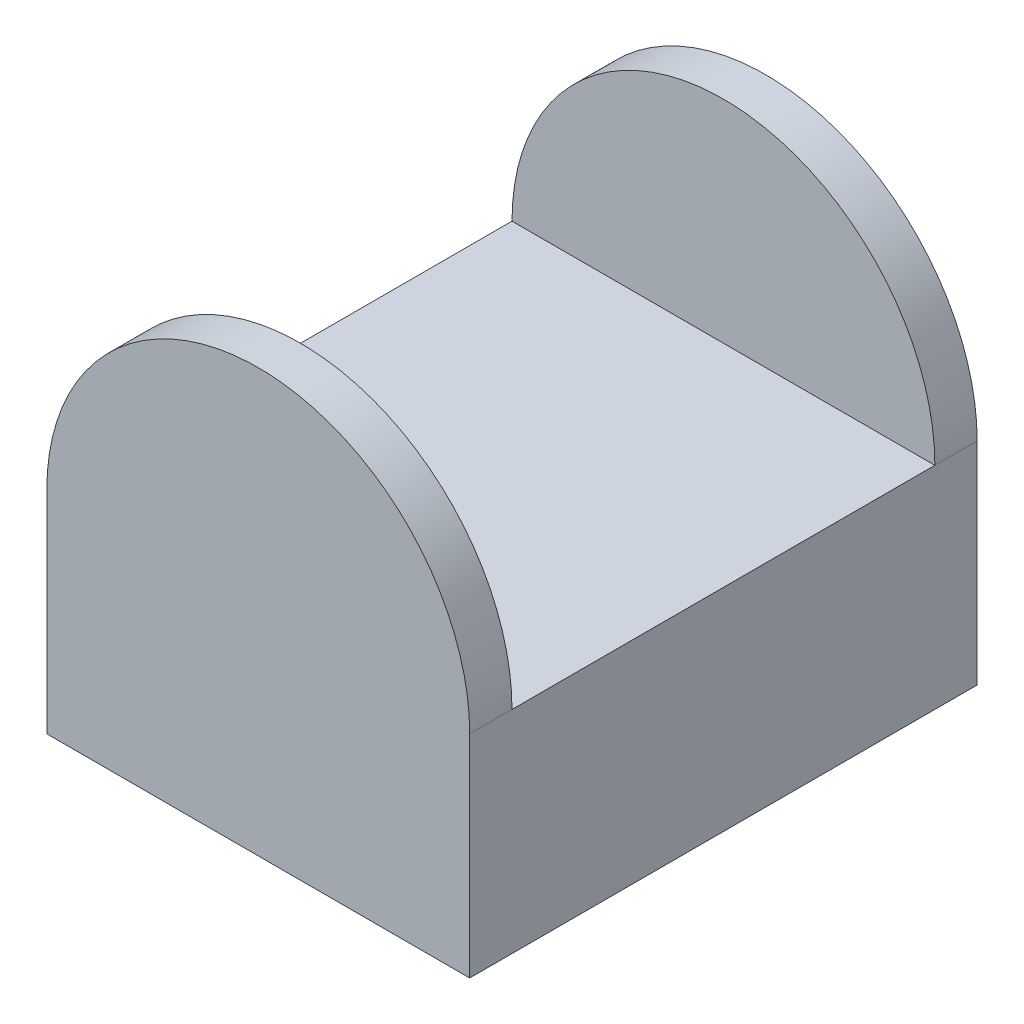
from build123d import *

# Parameters (mm, degrees)
BOSS_EXTRUDE1_DEPTH     = 30.48
CUT_EXTRUDE1_DEPTH      = 42.659097446
CUT_EXTRUDE1_DEPTH_BACK = 42.659097446
SKETCH3_W               = 25.4
SKETCH3_H               = 12.7


with BuildPart() as part:
    # Sketch2 → Boss-Extrude1 (new body)
    with BuildSketch(Plane.XY):
        with BuildLine():
            Line((-12.7, 0), (-12.7, -12.7))
            Line((-12.7, -12.7), (12.7, -12.7))
            Line((12.7, -12.7), (12.7, 0))
            ThreePointArc((12.7, 0), (0, 12.7), (-12.7, 0))
        make_face()
    extrude(amount=BOSS_EXTRUDE1_DEPTH)

    # Sketch3 → Cut-Extrude1 (cut, two sides: drawn at the far end of the back side and taken through both)
    with BuildSketch(Plane(origin=(12.7, 0, 0), x_dir=(0, 0, -1), z_dir=(1, 0, 0)).offset(-CUT_EXTRUDE1_DEPTH_BACK)):
        with Locations((-15.24, 6.35)):
            Rectangle(SKETCH3_W, SKETCH3_H)
    extrude(amount=CUT_EXTRUDE1_DEPTH + CUT_EXTRUDE1_DEPTH_BACK, mode=Mode.SUBTRACT)


solid = part.part
